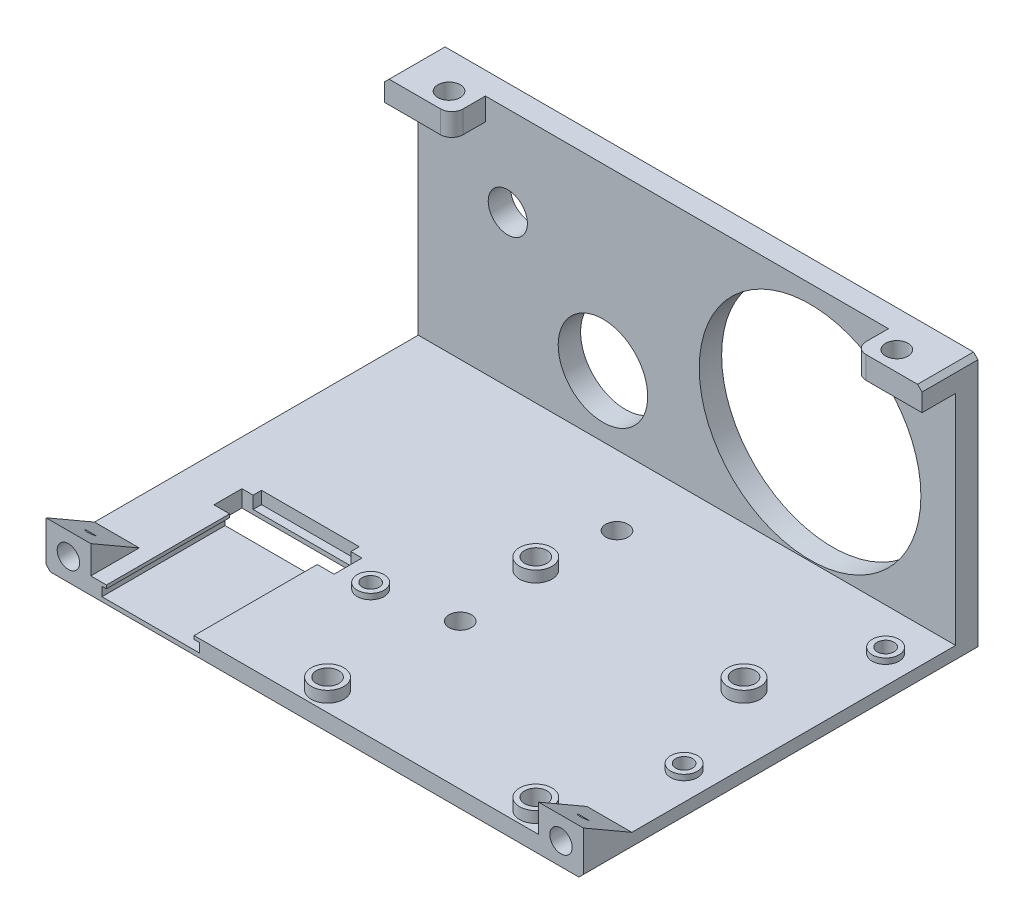
from build123d import *

# Parameters (mm, degrees)
SKETCH1_W           = 96
SKETCH1_H           = 70.5
BOSS_EXTRUDE1_DEPTH = 3
SKETCH2_W           = 96
SKETCH2_H           = 4
BOSS_EXTRUDE2_DEPTH = 43
SKETCH3_R           = 19.798989873
CUT_EXTRUDE1_DEPTH  = 128.680264724
SKETCH4_R           = 8
SKETCH4_R_2         = 3.5
CUT_EXTRUDE2_DEPTH  = 128.680264724
BOSS_EXTRUDE3_DEPTH = 8
SKETCH6_R           = 2
CUT_EXTRUDE3_DEPTH  = 4
SKETCH7_W           = 12
SKETCH7_H           = 10
BOSS_EXTRUDE4_DEPTH = 4
SKETCH8_R           = 2
CUT_EXTRUDE4_DEPTH  = 8
CHAMFER1_SIZE       = 0.8
SKETCH9_R           = 2
CUT_EXTRUDE5_DEPTH  = 8
SKETCH10_R          = 2.9
BOSS_EXTRUDE5_DEPTH = 2
SKETCH11_R          = 2
CUT_EXTRUDE6_DEPTH  = 126.965272992
CUT_EXTRUDE7_DEPTH  = 28
SKETCH13_W          = 21.46
SKETCH13_H          = 5
CUT_EXTRUDE8_DEPTH  = 127.630367606
SKETCH14_W          = 17.46
SKETCH14_H          = 2.22
CUT_EXTRUDE9_DEPTH  = 1.5
SKETCH15_R          = 1.5
CUT_EXTRUDE10_DEPTH = 127.630367606
BOSS_EXTRUDE6_START = 1
SKETCH16_R          = 2.4
SKETCH16_R_2        = 1.5
BOSS_EXTRUDE6_DEPTH = 1
FILLET1_R           = 2


with BuildPart() as part:
    # Sketch1 → Boss-Extrude1 (new body)
    with BuildSketch(Plane(origin=(0, 0, 0), x_dir=(1, 0, 0), z_dir=(0, 1, 0))):
        with Locations((48, -35.25)):
            Rectangle(SKETCH1_W, SKETCH1_H)
    extrude(amount=BOSS_EXTRUDE1_DEPTH)

    # Sketch2 → Boss-Extrude2 (add)
    with BuildSketch(Plane(origin=(0, 3, 0), x_dir=(1, 0, 0), z_dir=(0, 1, 0))):
        with Locations((48, -2)):
            Rectangle(SKETCH2_W, SKETCH2_H)
    extrude(amount=BOSS_EXTRUDE2_DEPTH)

    # Sketch3 → Cut-Extrude1 (cut, through all)
    with BuildSketch(Plane(origin=(0, 0, 0), x_dir=(-1, 0, 0), z_dir=(0, 0, -1))):
        with Locations((-70, 23)):
            Circle(SKETCH3_R)
    extrude(amount=-CUT_EXTRUDE1_DEPTH, mode=Mode.SUBTRACT)

    # Sketch4 → Cut-Extrude2 (cut, through all)
    with BuildSketch(Plane(origin=(0, 0, 0), x_dir=(-1, 0, 0), z_dir=(0, 0, -1))):
        with Locations((-33, 14)):
            Circle(SKETCH4_R)
        with Locations((-16, 30)):
            Circle(SKETCH4_R_2)
    extrude(amount=-CUT_EXTRUDE2_DEPTH, mode=Mode.SUBTRACT)

    # Sketch5 → Boss-Extrude3 (add)
    with BuildSketch(Plane.ZY):
        Polygon((61.839745962, 3), (70.5, 8), (70.5, 3), align=None)
    boss_extrude3 = extrude(amount=-BOSS_EXTRUDE3_DEPTH)

    # Sketch6 → Cut-Extrude3 (cut)
    with BuildSketch(Plane.XY.offset(70.5)):
        with Locations((4, 4)):
            Circle(SKETCH6_R)
    cut_extrude3 = extrude(amount=-CUT_EXTRUDE3_DEPTH, mode=Mode.SUBTRACT)

    # Mirror1: Boss-Extrude3, Cut-Extrude3 across plane
    add(boss_extrude3.mirror(Plane(origin=(48, 0, 0), x_dir=(0, 0, 1), z_dir=(1, 0, 0))))
    add(cut_extrude3.mirror(Plane(origin=(48, 0, 0), x_dir=(0, 0, 1), z_dir=(1, 0, 0))), mode=Mode.SUBTRACT)

    # Sketch7 → Boss-Extrude4 (add)
    with BuildSketch(Plane(origin=(0, 46, 0), x_dir=(1, 0, 0), z_dir=(0, 1, 0))):
        with Locations((6, -5)):
            Rectangle(SKETCH7_W, SKETCH7_H)
        with Locations((90, -5)):
            Rectangle(SKETCH7_W, SKETCH7_H)
    extrude(amount=-BOSS_EXTRUDE4_DEPTH)

    # Sketch8 → Cut-Extrude4 (cut)
    with BuildSketch(Plane(origin=(0, 46, 0), x_dir=(1, 0, 0), z_dir=(0, 1, 0))):
        with Locations((8, -6.5)):
            Circle(SKETCH8_R)
        with Locations((88, -6.5)):
            Circle(SKETCH8_R)
    extrude(amount=-CUT_EXTRUDE4_DEPTH, mode=Mode.SUBTRACT)

    # Chamfer1
    chamfer1_edges = [part.edges().sort_by_distance(p)[0] for p in [
        (0, 0, 35.25),
        (0, 46, 5),
        (96, 46, 5),
        (96, 0, 35.25),
    ]]
    chamfer(chamfer1_edges, length=CHAMFER1_SIZE)

    # Sketch9 → Cut-Extrude5 (cut)
    with BuildSketch(Plane.XZ):
        with Locations((48, 16.5)):
            Circle(SKETCH9_R)
        with Locations((48, 44.5)):
            Circle(SKETCH9_R)
    extrude(amount=-CUT_EXTRUDE5_DEPTH, mode=Mode.SUBTRACT)

    # Sketch10 → Boss-Extrude5 (add)
    with BuildSketch(Plane(origin=(0, 3, 0), x_dir=(1, 0, 0), z_dir=(0, 1, 0))):
        with Locations((84, -67)):
            Circle(SKETCH10_R)
        with Locations((46.8, -67)):
            Circle(SKETCH10_R)
        with Locations((46.8, -29.8)):
            Circle(SKETCH10_R)
        with Locations((84, -29.8)):
            Circle(SKETCH10_R)
    extrude(amount=BOSS_EXTRUDE5_DEPTH)

    # Sketch11 → Cut-Extrude6 (cut, through all)
    with BuildSketch(Plane(origin=(0, 5, 0), x_dir=(1, 0, 0), z_dir=(0, 1, 0))):
        with Locations((46.8, -67)):
            Circle(SKETCH11_R)
        with Locations((84, -67)):
            Circle(SKETCH11_R)
        with Locations((84, -29.8)):
            Circle(SKETCH11_R)
        with Locations((46.8, -29.8)):
            Circle(SKETCH11_R)
    extrude(amount=-CUT_EXTRUDE6_DEPTH, mode=Mode.SUBTRACT)

    # Sketch12 → Cut-Extrude7 (cut)
    with BuildSketch(Plane.XY.offset(70.5)):
        Polygon((10.8, 3), (10.8, 2.4), (10, 2.4), (10, 0.78), (27.46, 0.78), (27.46, 2.4), (26.46, 2.4), (26.46, 3), align=None)
    extrude(amount=-CUT_EXTRUDE7_DEPTH, mode=Mode.SUBTRACT)

    # Sketch13 → Cut-Extrude8 (cut, through all)
    with BuildSketch(Plane(origin=(0, 3, 0), x_dir=(1, 0, 0), z_dir=(0, 1, 0))):
        with Locations((18.73, -46)):
            Rectangle(SKETCH13_W, SKETCH13_H)
    extrude(amount=-CUT_EXTRUDE8_DEPTH, mode=Mode.SUBTRACT)

    # Sketch14 → Cut-Extrude9 (cut)
    with BuildSketch(Plane.XY.offset(43.5)):
        with Locations((18.73, 1.89)):
            Rectangle(SKETCH14_W, SKETCH14_H)
    extrude(amount=-CUT_EXTRUDE9_DEPTH, mode=Mode.SUBTRACT)

    # Sketch15 → Cut-Extrude10 (cut, through all)
    with BuildSketch(Plane(origin=(0, 3, 0), x_dir=(1, 0, 0), z_dir=(0, 1, 0))):
        with Locations((91, -47.5)):
            Circle(SKETCH15_R)
        with Locations((35, -47.5)):
            Circle(SKETCH15_R)
        with Locations((91, -11.5)):
            Circle(SKETCH15_R)
    extrude(amount=-CUT_EXTRUDE10_DEPTH, mode=Mode.SUBTRACT)

    # Sketch16 → Boss-Extrude6 (add)
    # profile 1 of 3: a face of its own
    with BuildSketch(Plane(origin=(0, 3, 0), x_dir=(1, 0, 0), z_dir=(0, 1, 0)).offset(BOSS_EXTRUDE6_START)):
        with Locations((91, -47.5)):
            Circle(SKETCH16_R)
        with Locations((91, -47.5)):
            Circle(SKETCH16_R_2, mode=Mode.SUBTRACT)
    # profile 2 of 3: a face of its own
    with BuildSketch(Plane(origin=(0, 3, 0), x_dir=(1, 0, 0), z_dir=(0, 1, 0)).offset(BOSS_EXTRUDE6_START)):
        with Locations((91, -11.5)):
            Circle(SKETCH16_R)
        with Locations((91, -11.5)):
            Circle(SKETCH16_R_2, mode=Mode.SUBTRACT)
    # profile 3 of 3: a face of its own
    with BuildSketch(Plane(origin=(0, 3, 0), x_dir=(1, 0, 0), z_dir=(0, 1, 0)).offset(BOSS_EXTRUDE6_START)):
        with Locations((35, -47.5)):
            Circle(SKETCH16_R)
        with Locations((35, -47.5)):
            Circle(SKETCH16_R_2, mode=Mode.SUBTRACT)
    extrude(amount=-BOSS_EXTRUDE6_DEPTH)

    # Fillet1
    fillet1_edges = [part.edges().sort_by_distance(p)[0] for p in [
        (84, 44, 10),
        (12, 44, 10),
    ]]
    fillet(fillet1_edges, radius=FILLET1_R)


solid = part.part
